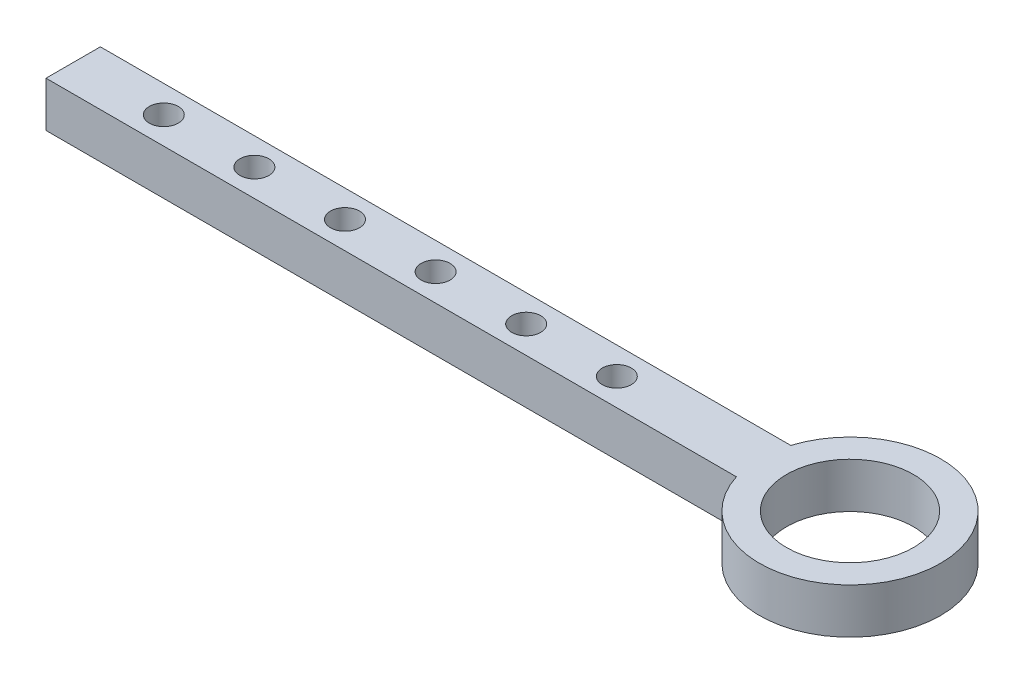
from build123d import *

# Parameters (mm, degrees)
SKETCH1_R           = 7
BOSS_EXTRUDE1_DEPTH = 5


with BuildPart() as part:
    # Sketch1 → Boss-Extrude1 (new body)
    # profile 1 of 7: a face of its own
    with BuildSketch(Plane(origin=(0, 0, 0), x_dir=(1, 0, 0), z_dir=(0, 1, 0))):
        with BuildLine():
            Line((76.2, 3), (76.2, 0))
            ThreePointArc((76.2, 0), (87.256969007, -6.884177258), (95.739392014, 3))
            ThreePointArc((95.739392014, 3), (87.256969007, 12.884177258), (76.2, 6))
            Line((76.2, 6), (76.2, 3))
        make_face()
        with Locations(Location((85.739392014, 3, 0), (0, 0, 270))):
            Circle(SKETCH1_R, mode=Mode.SUBTRACT)
    # profile 2 of 7: a face of its own
    with BuildSketch(Plane(origin=(0, 0, 0), x_dir=(1, 0, 0), z_dir=(0, 1, 0))):
        with BuildLine():
            ThreePointArc((75.739392014, 3), (75.855214756, 1.482423007), (76.2, 0))
            Line((76.2, 0), (76.2, 3))
            Line((76.2, 3), (75.739392014, 3))
        make_face()
    # profile 3 of 7: a face of its own
    with BuildSketch(Plane(origin=(0, 0, 0), x_dir=(1, 0, 0), z_dir=(0, 1, 0))):
        with BuildLine():
            Line((76.2, 3), (76.2, 6))
            ThreePointArc((76.2, 6), (75.855214756, 4.517576993), (75.739392014, 3))
            Line((75.739392014, 3), (76.2, 3))
        make_face()
    # profile 4 of 7: a face of its own
    with BuildSketch(Plane(origin=(0, 0, 0), x_dir=(1, 0, 0), z_dir=(0, 1, 0))):
        with BuildLine():
            ThreePointArc((75.739392014, 3), (75.855214756, 1.482423007), (76.2, 0))
            Line((76.2, 0), (76.2, 3))
            Line((76.2, 3), (75.739392014, 3))
        make_face()
    # profile 5 of 7: a face of its own
    with BuildSketch(Plane(origin=(0, 0, 0), x_dir=(1, 0, 0), z_dir=(0, 1, 0))):
        with BuildLine():
            Line((76.2, 3), (76.2, 6))
            ThreePointArc((76.2, 6), (75.855214756, 4.517576993), (75.739392014, 3))
            Line((75.739392014, 3), (76.2, 3))
        make_face()
    # profile 6 of 7: a face of its own
    with BuildSketch(Plane(origin=(0, 0, 0), x_dir=(1, 0, 0), z_dir=(0, 1, 0))):
        with BuildLine():
            Line((8.4, 3), (0, 3))
            Line((0, 3), (0, 0))
            Line((0, 0), (76.2, 0))
            ThreePointArc((76.2, 0), (75.855214756, 1.482423007), (75.739392014, 3))
            Line((75.739392014, 3), (61.6, 3))
            ThreePointArc((61.6, 3), (60, 1.4), (58.4, 3))
            Line((58.4, 3), (51.6, 3))
            ThreePointArc((51.6, 3), (50, 1.4), (48.4, 3))
            Line((48.4, 3), (41.6, 3))
            ThreePointArc((41.6, 3), (40, 1.4), (38.4, 3))
            Line((38.4, 3), (31.6, 3))
            ThreePointArc((31.6, 3), (30, 1.4), (28.4, 3))
            Line((28.4, 3), (21.6, 3))
            ThreePointArc((21.6, 3), (20, 1.4), (18.4, 3))
            Line((18.4, 3), (11.6, 3))
            ThreePointArc((11.6, 3), (10, 1.4), (8.4, 3))
        make_face()
    # profile 7 of 7: a face of its own
    with BuildSketch(Plane(origin=(0, 0, 0), x_dir=(1, 0, 0), z_dir=(0, 1, 0))):
        with BuildLine():
            Line((0, 6), (0, 3))
            Line((0, 3), (8.4, 3))
            ThreePointArc((8.4, 3), (10, 4.6), (11.6, 3))
            Line((11.6, 3), (18.4, 3))
            ThreePointArc((18.4, 3), (20, 4.6), (21.6, 3))
            Line((21.6, 3), (28.4, 3))
            ThreePointArc((28.4, 3), (30, 4.6), (31.6, 3))
            Line((31.6, 3), (38.4, 3))
            ThreePointArc((38.4, 3), (40, 4.6), (41.6, 3))
            Line((41.6, 3), (48.4, 3))
            ThreePointArc((48.4, 3), (50, 4.6), (51.6, 3))
            Line((51.6, 3), (58.4, 3))
            ThreePointArc((58.4, 3), (60, 4.6), (61.6, 3))
            Line((61.6, 3), (75.739392014, 3))
            ThreePointArc((75.739392014, 3), (75.855214756, 4.517576993), (76.2, 6))
            Line((76.2, 6), (0, 6))
        make_face()
    extrude(amount=BOSS_EXTRUDE1_DEPTH)


solid = part.part
